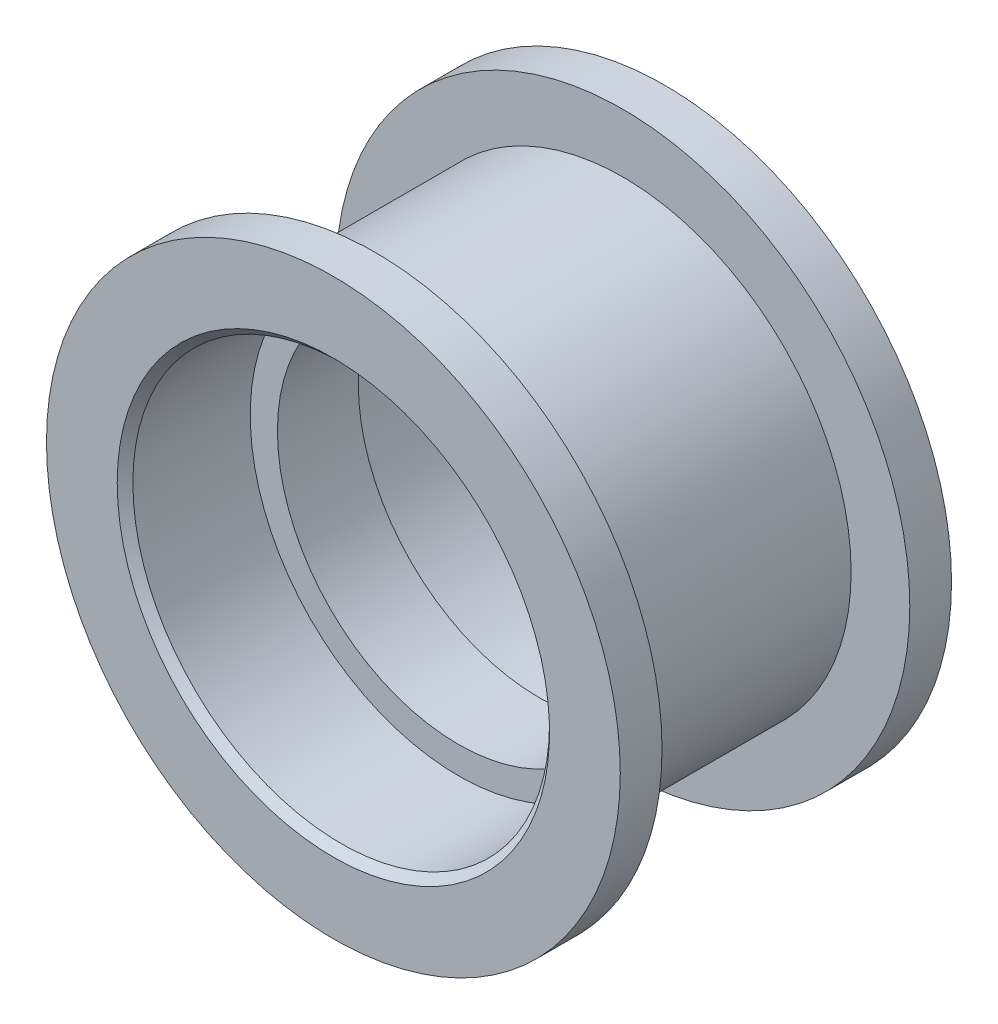
from build123d import *

# Parameters (mm, degrees)
CHAMFER1_SIZE = 0.3


with BuildPart() as part:
    # Sketch1 → Revolve1 (revolve)
    with BuildSketch(Plane(origin=(0, 0, 0), x_dir=(0, 0, -1), z_dir=(1, 0, 0)), mode=Mode.PRIVATE) as revolve1_sk:
        Polygon((4.75, 8.75), (-4.75, 8.75), (-4.75, 11), (-6.35, 11), (-6.35, 7.9875), (-1.55, 7.9875), (-1.55, 6.945), (1.55, 6.945), (1.55, 7.9875), (6.35, 7.9875), (6.35, 11), (4.75, 11), align=None)
    revolve(revolve1_sk.sketch.rotate(Axis((0, 0, 0), (0, 0, -1)), 90), axis=Axis((0, 0, 0), (0, 0, -1)))

    # Chamfer1
    chamfer1_edges = [part.edges().sort_by_distance(p)[0] for p in [
        (-7.9875, 0, 6.35),
        (-7.9875, 0, -6.35),
    ]]
    chamfer(chamfer1_edges, length=CHAMFER1_SIZE)


solid = part.part
